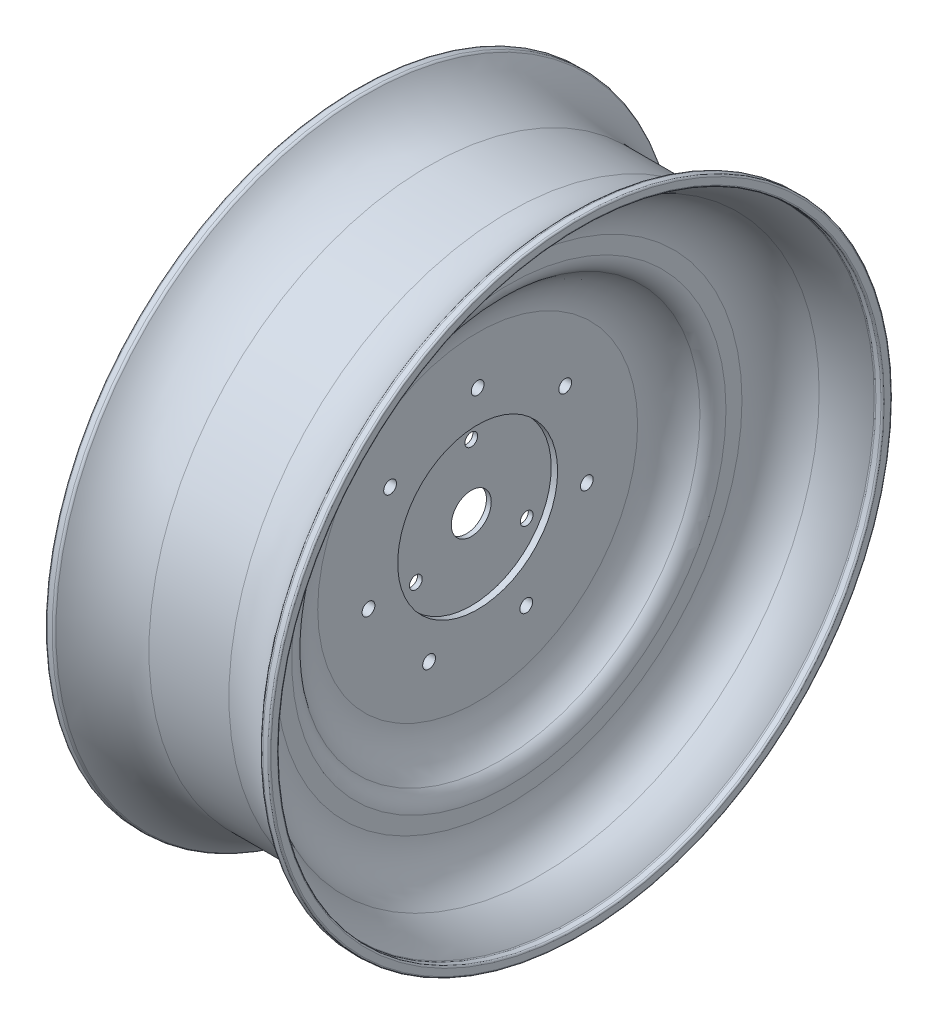
from build123d import *

# Parameters (mm, degrees)
SKETCH_2_R               = 4
CUT_EXTRUDE_1_DEPTH      = 285.541327873
PATTERN_CIRCULAR_1_COUNT = 3
SKETCH_3_R               = 4
CUT_EXTRUDE_2_DEPTH      = 286.572700496
PATTERN_CIRCULAR_2_COUNT = 7
CUT_EXTRUDE_3_DEPTH      = 285.541327873
CUT_EXTRUDE_3_DEPTH_BACK = 285.541327873
SKETCH_4_R               = 12.5


with BuildPart() as part:
    # 草图1 → 旋转1 (revolve)
    with BuildSketch(Plane.XY):
        with BuildLine():
            Line((1.5, 0), (-1.5, 0))
            Line((-1.5, 0), (-1.5, 50))
            Line((-1.5, 50), (-5.5, 50))
            Line((-5.5, 50), (-5.5, 100))
            ThreePointArc((-5.5, 100), (-9.163853982, 114.366885985), (-19.260494194, 125.224560476))
            ThreePointArc((-19.260494194, 125.224560476), (-23.471805525, 129.753299407), (-25, 135.745731391))
            Line((-25, 135.745731391), (-25, 145.746771531))
            ThreePointArc((-25, 145.746771531), (-30.375478829, 163.110900218), (-44.621473349, 174.400735373))
            ThreePointArc((-44.621473349, 174.400735373), (-55.642982017, 180.208310478), (-65.049762478, 188.376178209))
            ThreePointArc((-65.049762478, 188.376178209), (-65.384514917, 188.616445916), (-65.787728006, 188.7013398))
            Line((-65.787728006, 188.7013398), (-69, 188.7013398))
            ThreePointArc((-69, 188.7013398), (-69.707106781, 188.994233018), (-70, 189.7013398))
            Line((-70, 189.7013398), (-70, 193.745368641))
            ThreePointArc((-70, 193.745368641), (-69.707106781, 194.452475423), (-69, 194.745368641))
            Line((-69, 194.745368641), (-65.787728006, 194.745368641))
            ThreePointArc((-65.787728006, 194.745368641), (-64.916271034, 194.545524953), (-64.218969237, 193.985931386))
            ThreePointArc((-64.218969237, 193.985931386), (-46.78642432, 179.996092221), (-25, 175))
            Line((-25, 175), (25, 175))
            ThreePointArc((25, 175), (46.78642432, 179.996092221), (64.218969237, 193.985931386))
            ThreePointArc((64.218969237, 193.985931386), (64.916271034, 194.545524953), (65.787728006, 194.745368641))
            Line((65.787728006, 194.745368641), (69, 194.745368641))
            ThreePointArc((69, 194.745368641), (69.707106781, 194.452475423), (70, 193.745368641))
            Line((70, 193.745368641), (70, 189.7013398))
            ThreePointArc((70, 189.7013398), (69.707106781, 188.994233018), (69, 188.7013398))
            Line((69, 188.7013398), (65.787728006, 188.7013398))
            ThreePointArc((65.787728006, 188.7013398), (65.384514917, 188.616445916), (65.049762478, 188.376178209))
            ThreePointArc((65.049762478, 188.376178209), (55.642982017, 180.208310478), (44.621473349, 174.400735373))
            ThreePointArc((44.621473349, 174.400735373), (30.375478829, 163.110900218), (25, 145.746771531))
            Line((25, 145.746771531), (25, 135.745731391))
            ThreePointArc((25, 135.745731391), (23.471805525, 129.753299407), (19.260494194, 125.224560476))
            ThreePointArc((19.260494194, 125.224560476), (9.163853982, 114.366885985), (5.5, 100))
            Line((5.5, 100), (5.5, 50))
            Line((5.5, 50), (1.5, 50))
            Line((1.5, 50), (1.5, 0))
        make_face()
    revolve(axis=Axis((1.5, 0, 0), (-1, 0, 0)))

    # 草图2 → 切除-拉伸1 (cut, symmetric)
    with BuildSketch(Plane.ZY.offset(1.5)):
        with Locations((0, 40)):
            Circle(SKETCH_2_R)
    cut_extrude_1 = extrude(amount=CUT_EXTRUDE_1_DEPTH, both=True, mode=Mode.SUBTRACT)

    # 阵列(圆周)1: 切除-拉伸1 ×3 about axis
    pattern_circular_1_axis = Axis((-25, 0, 0), (1, 0, 0))
    for i in range(1, PATTERN_CIRCULAR_1_COUNT):
        add(cut_extrude_1.rotate(pattern_circular_1_axis, i * 360 / PATTERN_CIRCULAR_1_COUNT), mode=Mode.SUBTRACT)

    # 草图3 → 切除-拉伸2 (cut, symmetric)
    with BuildSketch(Plane.ZY.offset(5.5)):
        with Locations((0, 70)):
            Circle(SKETCH_3_R)
    cut_extrude_2 = extrude(amount=CUT_EXTRUDE_2_DEPTH, both=True, mode=Mode.SUBTRACT)

    # 阵列(圆周)2: 切除-拉伸2 ×7 about axis
    pattern_circular_2_axis = Axis((-25, 0, 0), (1, 0, 0))
    for i in range(1, PATTERN_CIRCULAR_2_COUNT):
        add(cut_extrude_2.rotate(pattern_circular_2_axis, i * 360 / PATTERN_CIRCULAR_2_COUNT), mode=Mode.SUBTRACT)

    # 草图4 → 切除-拉伸3 (cut, two sides: drawn at the far end of the back side and taken through both)
    with BuildSketch(Plane.ZY.offset(1.5).offset(-CUT_EXTRUDE_3_DEPTH_BACK)):
        Circle(SKETCH_4_R)
    extrude(amount=CUT_EXTRUDE_3_DEPTH + CUT_EXTRUDE_3_DEPTH_BACK, mode=Mode.SUBTRACT)


solid = part.part
